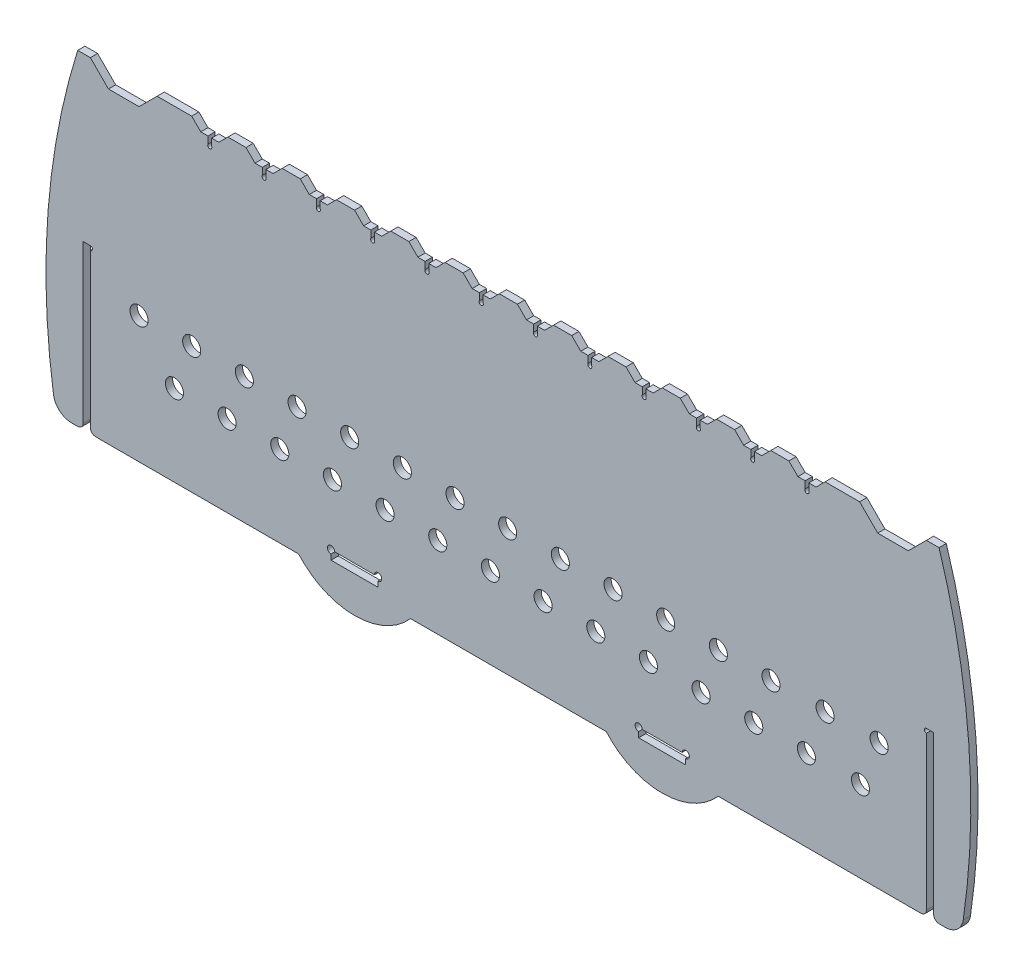
from build123d import *

# Parameters (mm, degrees)
SKETCH_1_R      = 5
EXTRUDE_1_DEPTH = 4


with BuildPart() as part:
    # Эскиз1 → Бобышка-Вытянуть1 (new body)
    with BuildSketch(Plane.XY):
        with BuildLine():
            Line((8.526879851, 0), (12, 0))
            ThreePointArc((12, 0), (14.121320344, 0.878679656), (15, 3))
            Line((15, 3), (15, 90))
            Line((15, 90), (19, 90))
            ThreePointArc((19, 90), (20.154255418, 88.845744582), (19, 87.691489165))
            Line((19, 87.691489165), (19, 3))
            ThreePointArc((19, 3), (19.878679656, 0.878679656), (22, 0))
            Line((22, 0), (134.07411748, 0))
            ThreePointArc((134.07411748, 0), (165, -14), (195.92588252, 0))
            Line((195.92588252, 0), (304.07411748, 0))
            ThreePointArc((304.07411748, 0), (335, -14), (365.92588252, 0))
            Line((365.92588252, 0), (478, 0))
            ThreePointArc((478, 0), (480.121320344, 0.878679656), (481, 3))
            Line((481, 3), (481, 87.691489165))
            ThreePointArc((481, 87.691489165), (479.845744582, 88.845744582), (481, 90))
            Line((481, 90), (485, 90))
            Line((485, 90), (485, 3))
            ThreePointArc((485, 3), (485.878679656, 0.878679656), (488, 0))
            Line((488, 0), (491.473120149, 0))
            ThreePointArc((491.473120149, 0), (498.004324615, 2.427459592), (501.364682095, 8.531326355))
            ThreePointArc((501.364682095, 8.531326355), (504.376413281, 95.021242555), (488, 180))
            Line((488, 180), (481, 180))
            Line((481, 180), (471, 170))
            Line((471, 170), (454.102752641, 170))
            Line((454.102752641, 170), (444.102752641, 180))
            Line((444.102752641, 180), (425, 180))
            Line((425, 180), (420, 175))
            Line((420, 175), (416, 175))
            Line((416, 175), (416, 171.109370144))
            ThreePointArc((416, 171.109370144), (415, 169.411148659), (414, 171.109370144))
            Line((414, 171.109370144), (414, 175))
            Line((414, 175), (410, 175))
            Line((410, 175), (405, 180))
            Line((405, 180), (395, 180))
            Line((395, 180), (390, 175))
            Line((390, 175), (386, 175))
            Line((386, 175), (386, 171.109370144))
            ThreePointArc((386, 171.109370144), (385, 169.411148659), (384, 171.109370144))
            Line((384, 171.109370144), (384, 175))
            Line((384, 175), (380, 175))
            Line((380, 175), (375, 180))
            Line((375, 180), (365, 180))
            Line((365, 180), (360, 175))
            Line((360, 175), (356, 175))
            Line((356, 175), (356, 171.109370144))
            ThreePointArc((356, 171.109370144), (355, 169.411148659), (354, 171.109370144))
            Line((354, 171.109370144), (354, 175))
            Line((354, 175), (350, 175))
            Line((350, 175), (345, 180))
            Line((345, 180), (335, 180))
            Line((335, 180), (330, 175))
            Line((330, 175), (326, 175))
            Line((326, 175), (326, 171.109370144))
            ThreePointArc((326, 171.109370144), (325, 169.411148659), (324, 171.109370144))
            Line((324, 171.109370144), (324, 175))
            Line((324, 175), (320, 175))
            Line((320, 175), (315, 180))
            Line((315, 180), (305, 180))
            Line((305, 180), (300, 175))
            Line((300, 175), (296, 175))
            Line((296, 175), (296, 171.109370144))
            ThreePointArc((296, 171.109370144), (295, 169.411148659), (294, 171.109370144))
            Line((294, 171.109370144), (294, 175))
            Line((294, 175), (290, 175))
            Line((290, 175), (285, 180))
            Line((285, 180), (275, 180))
            Line((275, 180), (270, 175))
            Line((270, 175), (266, 175))
            Line((266, 175), (266, 171.109370144))
            ThreePointArc((266, 171.109370144), (265, 169.411148659), (264, 171.109370144))
            Line((264, 171.109370144), (264, 175))
            Line((264, 175), (260, 175))
            Line((260, 175), (255, 180))
            Line((255, 180), (245, 180))
            Line((245, 180), (240, 175))
            Line((240, 175), (236, 175))
            Line((236, 175), (236, 171.109370144))
            ThreePointArc((236, 171.109370144), (235, 169.411148659), (234, 171.109370144))
            Line((234, 171.109370144), (234, 175))
            Line((234, 175), (230, 175))
            Line((230, 175), (225, 180))
            Line((225, 180), (215, 180))
            Line((215, 180), (210, 175))
            Line((210, 175), (206, 175))
            Line((206, 175), (206, 171.109370144))
            ThreePointArc((206, 171.109370144), (205, 169.411148659), (204, 171.109370144))
            Line((204, 171.109370144), (204, 175))
            Line((204, 175), (200, 175))
            Line((200, 175), (195, 180))
            Line((195, 180), (185, 180))
            Line((185, 180), (180, 175))
            Line((180, 175), (176, 175))
            Line((176, 175), (176, 171.109370144))
            ThreePointArc((176, 171.109370144), (175, 169.411148659), (174, 171.109370144))
            Line((174, 171.109370144), (174, 175))
            Line((174, 175), (170, 175))
            Line((170, 175), (165, 180))
            Line((165, 180), (155, 180))
            Line((155, 180), (150, 175))
            Line((150, 175), (146, 175))
            Line((146, 175), (146, 171.109370144))
            ThreePointArc((146, 171.109370144), (145, 169.411148659), (144, 171.109370144))
            Line((144, 171.109370144), (144, 175))
            Line((144, 175), (140, 175))
            Line((140, 175), (135, 180))
            Line((135, 180), (125, 180))
            Line((125, 180), (120, 175))
            Line((120, 175), (116, 175))
            Line((116, 175), (116, 171.109370144))
            ThreePointArc((116, 171.109370144), (115, 169.411148659), (114, 171.109370144))
            Line((114, 171.109370144), (114, 175))
            Line((114, 175), (110, 175))
            Line((110, 175), (105, 180))
            Line((105, 180), (95, 180))
            Line((95, 180), (90, 175))
            Line((90, 175), (86, 175))
            Line((86, 175), (86, 171.109370144))
            ThreePointArc((86, 171.109370144), (85, 169.411148659), (84, 171.109370144))
            Line((84, 171.109370144), (84, 175))
            Line((84, 175), (80, 175))
            Line((80, 175), (75, 180))
            Line((75, 180), (55.897247359, 180))
            Line((55.897247359, 180), (45.897247359, 170))
            Line((45.897247359, 170), (29, 170))
            Line((29, 170), (19, 180))
            Line((19, 180), (12, 180))
            ThreePointArc((12, 180), (-4.376413281, 95.021242555), (-1.364682095, 8.531326355))
            ThreePointArc((-1.364682095, 8.531326355), (1.995675385, 2.427459592), (8.526879851, 0))
        make_face()
        with Locations((45.897247359, 70)):
            Circle(SKETCH_1_R, mode=Mode.SUBTRACT)
        with Locations((65.46620575, 45)):
            Circle(SKETCH_1_R, mode=Mode.SUBTRACT)
        with Locations((75, 70)):
            Circle(SKETCH_1_R, mode=Mode.SUBTRACT)
        with Locations((94.568958391, 45)):
            Circle(SKETCH_1_R, mode=Mode.SUBTRACT)
        with Locations((104.102752641, 70)):
            Circle(SKETCH_1_R, mode=Mode.SUBTRACT)
        with Locations((123.671711032, 45)):
            Circle(SKETCH_1_R, mode=Mode.SUBTRACT)
        with Locations((133.205505282, 70)):
            Circle(SKETCH_1_R, mode=Mode.SUBTRACT)
        with Locations((152.774463674, 45)):
            Circle(SKETCH_1_R, mode=Mode.SUBTRACT)
        with Locations((162.308257923, 70)):
            Circle(SKETCH_1_R, mode=Mode.SUBTRACT)
        with Locations((181.877216315, 45)):
            Circle(SKETCH_1_R, mode=Mode.SUBTRACT)
        with Locations((191.411010565, 70)):
            Circle(SKETCH_1_R, mode=Mode.SUBTRACT)
        with Locations((210.979968956, 45)):
            Circle(SKETCH_1_R, mode=Mode.SUBTRACT)
        with Locations((220.513763206, 70)):
            Circle(SKETCH_1_R, mode=Mode.SUBTRACT)
        with Locations((240.082721597, 45)):
            Circle(SKETCH_1_R, mode=Mode.SUBTRACT)
        with Locations((249.616515847, 70)):
            Circle(SKETCH_1_R, mode=Mode.SUBTRACT)
        with Locations((269.185474238, 45)):
            Circle(SKETCH_1_R, mode=Mode.SUBTRACT)
        with Locations((278.719268488, 70)):
            Circle(SKETCH_1_R, mode=Mode.SUBTRACT)
        with Locations((298.288226879, 45)):
            Circle(SKETCH_1_R, mode=Mode.SUBTRACT)
        with Locations((307.822021129, 70)):
            Circle(SKETCH_1_R, mode=Mode.SUBTRACT)
        with Locations((327.39097952, 45)):
            Circle(SKETCH_1_R, mode=Mode.SUBTRACT)
        with Locations((336.92477377, 70)):
            Circle(SKETCH_1_R, mode=Mode.SUBTRACT)
        with Locations((356.493732162, 45)):
            Circle(SKETCH_1_R, mode=Mode.SUBTRACT)
        with Locations((366.027526411, 70)):
            Circle(SKETCH_1_R, mode=Mode.SUBTRACT)
        with Locations((385.596484803, 45)):
            Circle(SKETCH_1_R, mode=Mode.SUBTRACT)
        with Locations((395.130279053, 70)):
            Circle(SKETCH_1_R, mode=Mode.SUBTRACT)
        with Locations((414.699237444, 45)):
            Circle(SKETCH_1_R, mode=Mode.SUBTRACT)
        with Locations((425, 70)):
            Circle(SKETCH_1_R, mode=Mode.SUBTRACT)
        with Locations((444.568958391, 45)):
            Circle(SKETCH_1_R, mode=Mode.SUBTRACT)
        with Locations((454.869720947, 70)):
            Circle(SKETCH_1_R, mode=Mode.SUBTRACT)
        with BuildLine():
            Line((152, 6), (178, 6))
            Line((178, 6), (178, 9))
            ThreePointArc((178, 9), (179.414213562, 12.414213562), (176, 11))
            Line((176, 11), (154, 11))
            ThreePointArc((154, 11), (150.585786438, 12.414213562), (152, 9))
            Line((152, 9), (152, 6))
        make_face(mode=Mode.SUBTRACT)
        with BuildLine():
            Line((322, 6), (348, 6))
            Line((348, 6), (348, 9))
            ThreePointArc((348, 9), (349.414213562, 12.414213562), (346, 11))
            Line((346, 11), (324, 11))
            ThreePointArc((324, 11), (320.585786438, 12.414213562), (322, 9))
            Line((322, 9), (322, 6))
        make_face(mode=Mode.SUBTRACT)
    extrude(amount=EXTRUDE_1_DEPTH)


solid = part.part
